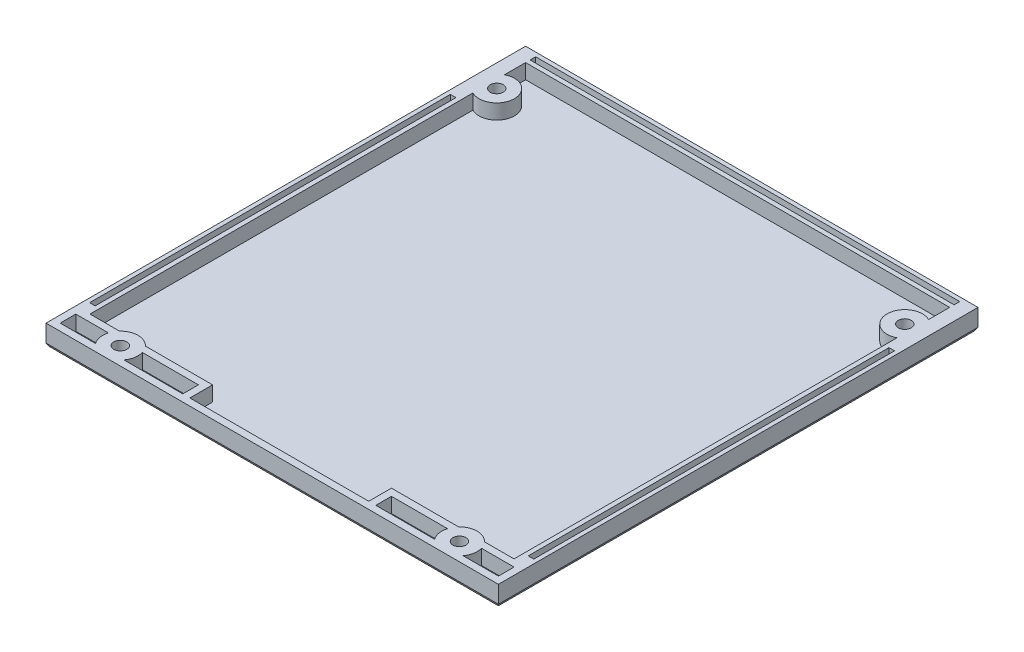
from build123d import *

# Parameters (mm, degrees)
SKETCH_1_W          = 121.4
SKETCH_1_H          = 128.7
EXTRUDE_1_DEPTH     = 1.5
EXTRUDE_2_DEPTH     = 2
SKETCH_3_W          = 1.5
SKETCH_3_H          = 96.8
SKETCH_3_W_2        = 113.8
SKETCH_3_H_2        = 1.5
EXTRUDE_3_DEPTH     = 2
SKETCH_5_W          = 121.4
SKETCH_5_H          = 8
SKETCH_5_W_2        = 32.9
SKETCH_5_H_2        = 4.2
SKETCH_5_W_3        = 48
EXTRUDE_5_DEPTH     = 4
SKETCH_7_R          = 4.75
EXTRUDE_10_DEPTH    = 4
SKETCH_8_R          = 1.75
CUT_EXTRUDE_3_DEPTH = 5.5
CHAMFER_1_SIZE      = 1.6
SKETCH_10_W         = 48
SKETCH_10_H         = 6.1
CUT_EXTRUDE_4_DEPTH = 4
CHAMFER_2_SIZE      = 0.5
CHAMFER_2_SIZE2     = 0.866025404


with BuildPart() as part:
    # Эскиз1 → Бобышка-Вытянуть1 (new body)
    with BuildSketch(Plane(origin=(0, 0, 0), x_dir=(1, 0, 0), z_dir=(0, 1, 0))):
        with Locations((60.7, 64.35)):
            Rectangle(SKETCH_1_W, SKETCH_1_H)
    extrude(amount=EXTRUDE_1_DEPTH)

    # Эскиз2 → Бобышка-Вытянуть2 (add)
    with BuildSketch(Plane(origin=(0, 1.5, 0), x_dir=(1, 0, 0), z_dir=(0, 1, 0))):
        Polygon((0, 8), (0, 128.7), (121.4, 128.7), (121.4, 8), (117.6, 8), (117.6, 124.9), (3.8, 124.9), (3.8, 8), align=None)
    extrude(amount=EXTRUDE_2_DEPTH)

    # Эскиз3 → Бобышка-Вытянуть3 (add)
    with BuildSketch(Plane(origin=(0, 3.5, 0), x_dir=(1, 0, 0), z_dir=(0, 1, 0))):
        Polygon((0, 8), (3.8, 8), (3.8, 124.9), (117.6, 124.9), (117.6, 8), (121.4, 8), (121.4, 128.7), (0, 128.7), align=None)
        with Locations((1.85, 59)):
            Rectangle(SKETCH_3_W, SKETCH_3_H, mode=Mode.SUBTRACT)
        with Locations((60.7, 126.85)):
            Rectangle(SKETCH_3_W_2, SKETCH_3_H_2, mode=Mode.SUBTRACT)
        with Locations((119.55, 59)):
            Rectangle(SKETCH_3_W, SKETCH_3_H, mode=Mode.SUBTRACT)
    extrude(amount=EXTRUDE_3_DEPTH)

    # Эскиз5 → Бобышка-Вытянуть5 (add)
    with BuildSketch(Plane(origin=(0, 1.5, 0), x_dir=(1, 0, 0), z_dir=(0, 1, 0))):
        with Locations((60.7, 4)):
            Rectangle(SKETCH_5_W, SKETCH_5_H)
        with Locations((18.35, 4)):
            Rectangle(SKETCH_5_W_2, SKETCH_5_H_2, mode=Mode.SUBTRACT)
        with Locations((103.05, 4)):
            Rectangle(SKETCH_5_W_2, SKETCH_5_H_2, mode=Mode.SUBTRACT)
        with Locations((60.7, 4)):
            Rectangle(SKETCH_5_W_3, SKETCH_5_H_2, mode=Mode.SUBTRACT)
    extrude(amount=EXTRUDE_5_DEPTH)

    # Эскиз7 → Бобышка-Вытянуть10 (add)
    with BuildSketch(Plane(origin=(0, 1.5, 0), x_dir=(1, 0, 0), z_dir=(0, 1, 0))):
        with Locations((5.95, 115)):
            Circle(SKETCH_7_R)
        with Locations((115.45, 115)):
            Circle(SKETCH_7_R)
        with Locations((15.2, 4.75)):
            Circle(SKETCH_7_R)
        with Locations((106.2, 4.75)):
            Circle(SKETCH_7_R)
    extrude(amount=EXTRUDE_10_DEPTH)

    # Эскиз8 → Вырез-Вытянуть3 (cut)
    with BuildSketch(Plane.XZ):
        with Locations(Location((15.2, -4.75, 0), (0, 0, 270))):
            Circle(SKETCH_8_R)
        with Locations(Location((106.2, -4.75, 0), (0, 0, 270))):
            Circle(SKETCH_8_R)
        with Locations(Location((5.95, -115, 0), (0, 0, 270))):
            Circle(SKETCH_8_R)
        with Locations(Location((115.45, -115, 0), (0, 0, 270))):
            Circle(SKETCH_8_R)
    extrude(amount=-CUT_EXTRUDE_3_DEPTH, mode=Mode.SUBTRACT)

    # Фаска1
    chamfer_1_edges = [part.edges().sort_by_distance(p)[0] for p in [
        (115.45, 0, -113.25),
        (5.95, 0, -113.25),
        (106.2, 0, -3),
        (15.2, 0, -3),
    ]]
    chamfer(chamfer_1_edges, length=CHAMFER_1_SIZE)

    # Эскиз10 → Вырез-Вытянуть4 (cut)
    with BuildSketch(Plane(origin=(0, 5.5, 0), x_dir=(1, 0, 0), z_dir=(0, 1, 0))):
        with Locations((60.7, 4.95)):
            Rectangle(SKETCH_10_W, SKETCH_10_H)
    extrude(amount=-CUT_EXTRUDE_4_DEPTH, mode=Mode.SUBTRACT)

    # Фаска2
    chamfer_2_edges = [part.edges().sort_by_distance(p)[0] for p in [
        (0, 0, -64.35),
        (60.7, 0, -128.7),
        (121.4, 0, -64.35),
        (60.7, 0, 0),
    ]]
    chamfer_2_side = [part.faces().sort_by_distance(p)[0] for p in [
        (60.7, 0, -64.390759898),
    ]]
    chamfer(chamfer_2_edges, length=CHAMFER_2_SIZE, length2=CHAMFER_2_SIZE2, reference=chamfer_2_side[0])


solid = part.part
